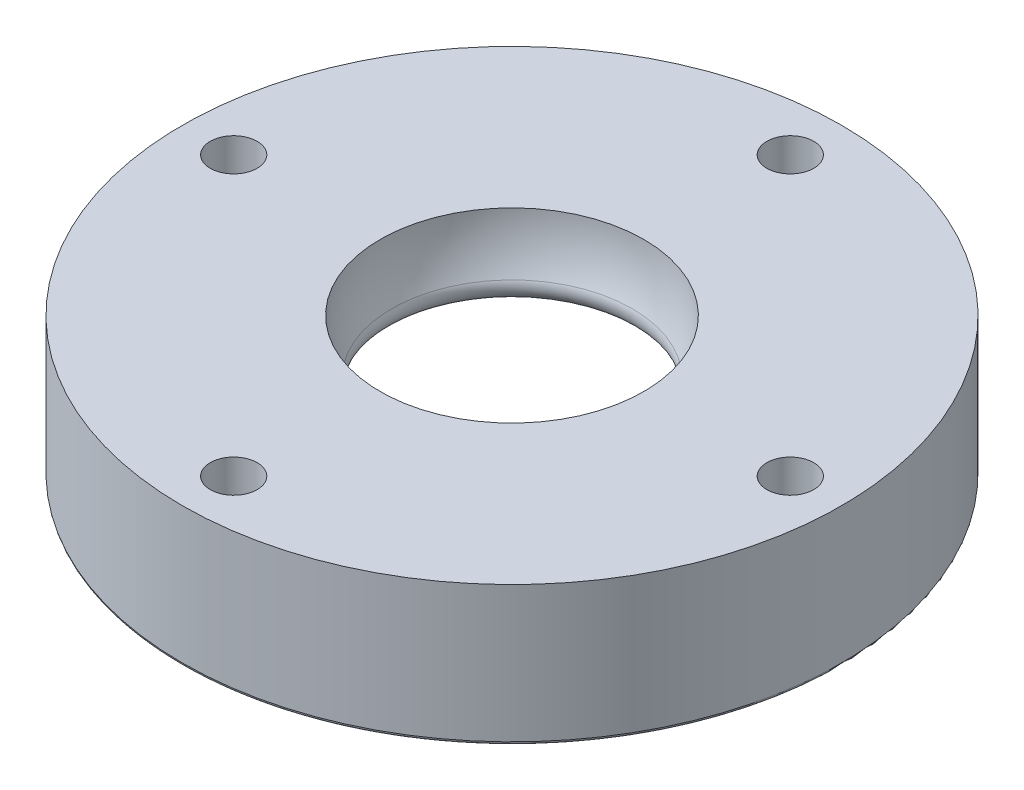
from build123d import *

# Parameters (mm, degrees)
SKETCH2_R          = 1.6
CUT_EXTRUDE1_DEPTH = 10
FILLET1_R          = 0.2
FILLET2_R          = 1


with BuildPart() as part:
    # Sketch1 → Revolve1 (revolve)
    with BuildSketch(Plane.XY):
        with BuildLine():
            ThreePointArc((-7.794228634, -4.5), (-8.693332437, -2.329371406), (-9, 0))
            Line((-9, 0), (-22.5, 0))
            Line((-22.5, 0), (-22.5, -9.5))
            Line((-22.5, -9.5), (-16.454482672, -9.5))
            Line((-16.454482672, -9.5), (-7.794228634, -4.5))
        make_face()
    revolve(axis=Axis((0, 0, 0), (0, 1, 0)))

    # Sketch2 → Cut-Extrude1 (cut)
    with BuildSketch(Plane(origin=(0, 0, 0), x_dir=(1, 0, 0), z_dir=(0, 1, 0))):
        with Locations((-19, 0)):
            Circle(SKETCH2_R)
        with Locations((0, 19)):
            Circle(SKETCH2_R)
        with Locations((19, 0)):
            Circle(SKETCH2_R)
        with Locations((0, -19)):
            Circle(SKETCH2_R)
    extrude(amount=-CUT_EXTRUDE1_DEPTH, mode=Mode.SUBTRACT)

    # Fillet1
    fillet1_edges = [part.edges().sort_by_distance(p)[0] for p in [
        (16.454482672, -9.5, 0),
        (22.5, -9.5, 0),
        (-20.6, -9.5, 0),
        (-1.6, -9.5, -19),
        (17.4, -9.5, 0),
        (-1.6, -9.5, 19),
    ]]
    fillet(fillet1_edges, radius=FILLET1_R)

    # Fillet2
    fillet2_edges = [part.edges().sort_by_distance(p)[0] for p in [
        (7.794228634, -4.5, 0),
    ]]
    fillet(fillet2_edges, radius=FILLET2_R)


solid = part.part
